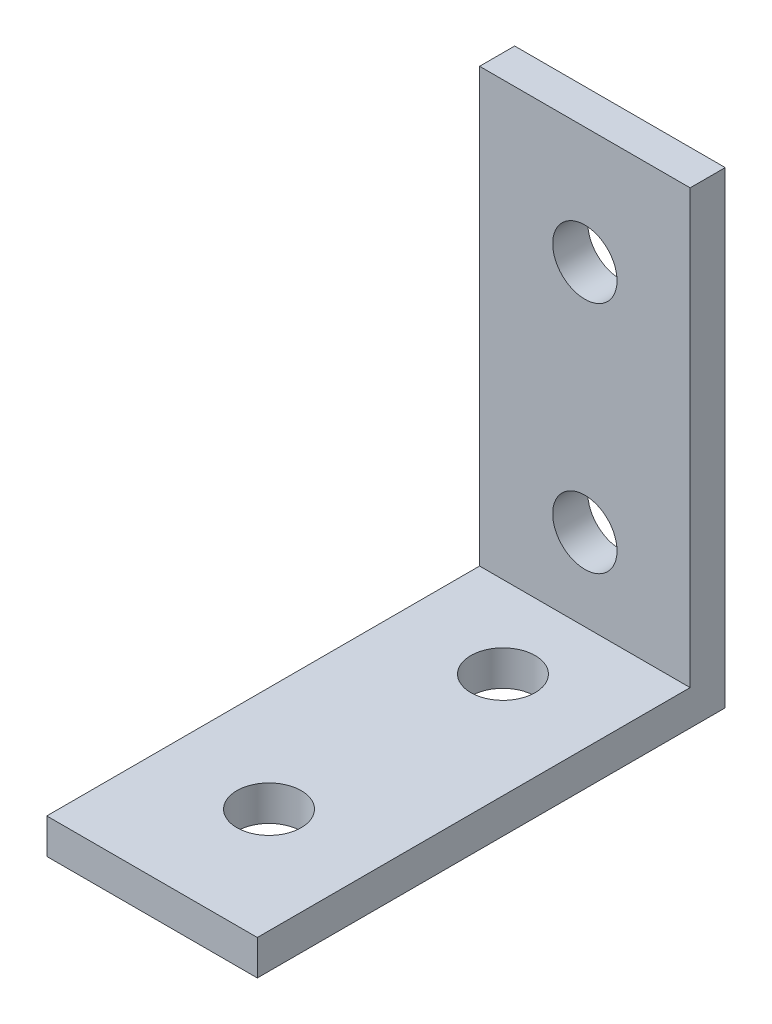
from build123d import *

# Parameters (mm, degrees)
SKETCH_1_W          = 18
SKETCH_1_H          = 40
SKETCH_1_R          = 2.75
EXTRUDE_1_DEPTH     = 3
SKETCH_2_W          = 18
SKETCH_2_H          = 3
EXTRUDE_2_DEPTH     = 37
SKETCH_3_R          = 2.75
CUT_EXTRUDE_1_DEPTH = 37


with BuildPart() as part:
    # 草图1 → 凸台-拉伸1 (new body)
    with BuildSketch(Plane(origin=(0, 0, 0), x_dir=(1, 0, 0), z_dir=(0, 1, 0))):
        Rectangle(SKETCH_1_W, SKETCH_1_H)
        with Locations(Location((0, -10, 0), (0, 0, 270))):
            Circle(SKETCH_1_R, mode=Mode.SUBTRACT)
        with Locations(Location((0, 10, 0), (0, 0, 270))):
            Circle(SKETCH_1_R, mode=Mode.SUBTRACT)
    extrude(amount=EXTRUDE_1_DEPTH)

    # 草图2 → 凸台-拉伸2 (add)
    with BuildSketch(Plane(origin=(0, 3, 0), x_dir=(1, 0, 0), z_dir=(0, 1, 0))):
        with Locations((0, 18.5)):
            Rectangle(SKETCH_2_W, SKETCH_2_H)
    extrude(amount=EXTRUDE_2_DEPTH)

    # 草图3 → 切除-拉伸1 (cut)
    with BuildSketch(Plane.XY.offset(-17)):
        with Locations((0, 30)):
            Circle(SKETCH_3_R)
        with Locations((0, 10)):
            Circle(SKETCH_3_R)
    extrude(amount=-CUT_EXTRUDE_1_DEPTH, mode=Mode.SUBTRACT)


solid = part.part
